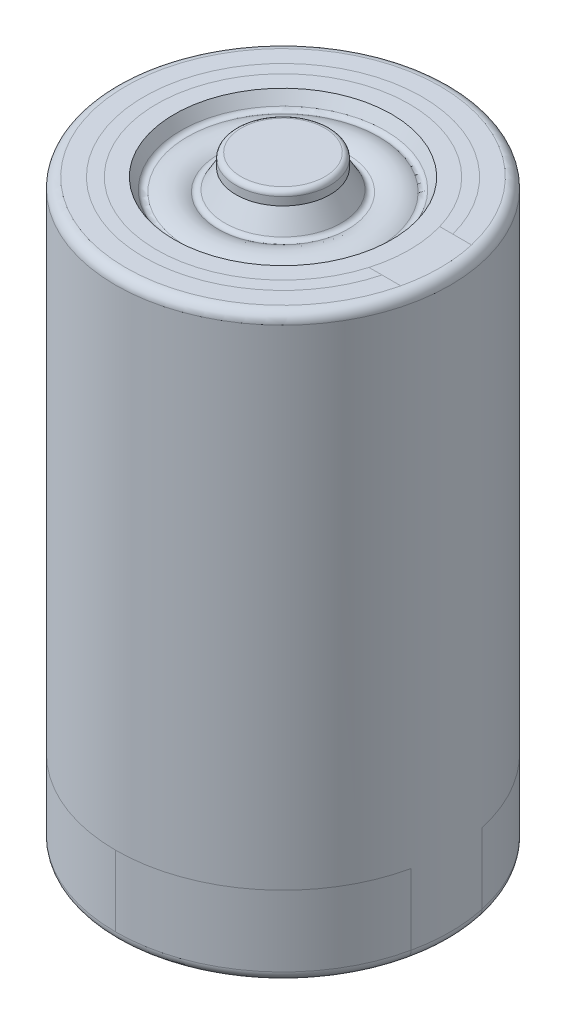
from build123d import *


with BuildPart() as part:
    # Sketch2 → Revolve1 (revolve)
    with BuildSketch(Plane.XY, mode=Mode.PRIVATE) as revolve1_sk:
        with BuildLine():
            Line((0, 0), (9, 0))
            Line((9, 0), (9.866025404, 0.5))
            Line((9.866025404, 0.5), (11.5, 0.5))
            ThreePointArc((11.5, 0.5), (12.207106781, 0.792893219), (12.5, 1.5))
            Line((12.5, 1.5), (15.55, 1.5))
            ThreePointArc((15.55, 1.5), (16.257106781, 1.792893219), (16.55, 2.5))
            Line((16.55, 2.5), (16.55, 57.9))
            ThreePointArc((16.55, 57.9), (16.257106781, 58.607106781), (15.55, 58.9))
            Line((15.55, 58.9), (10.75, 58.9))
            Line((10.75, 58.9), (10.121453307, 57.811325193))
            ThreePointArc((10.121453307, 57.811325193), (9.826135517, 57.580658873), (9.453477498, 57.619972344))
            ThreePointArc((9.453477498, 57.619972344), (7.930940108, 58), (6.408402718, 57.619972344))
            ThreePointArc((6.408402718, 57.619972344), (6.035744698, 57.580658873), (5.740426908, 57.811325193))
            Line((5.740426908, 57.811325193), (4.65, 59.7))
            Line((4.65, 59.7), (4.65, 60.5))
            ThreePointArc((4.65, 60.5), (4.503553391, 60.853553391), (4.15, 61))
            Line((4.15, 61), (0, 61))
            Line((0, 61), (0, 0))
        make_face()
    revolve(revolve1_sk.sketch.rotate(Axis((0, 0, 0), (0, 1, 0)), 90), axis=Axis((0, 0, 0), (0, 1, 0)))


solid = part.part
